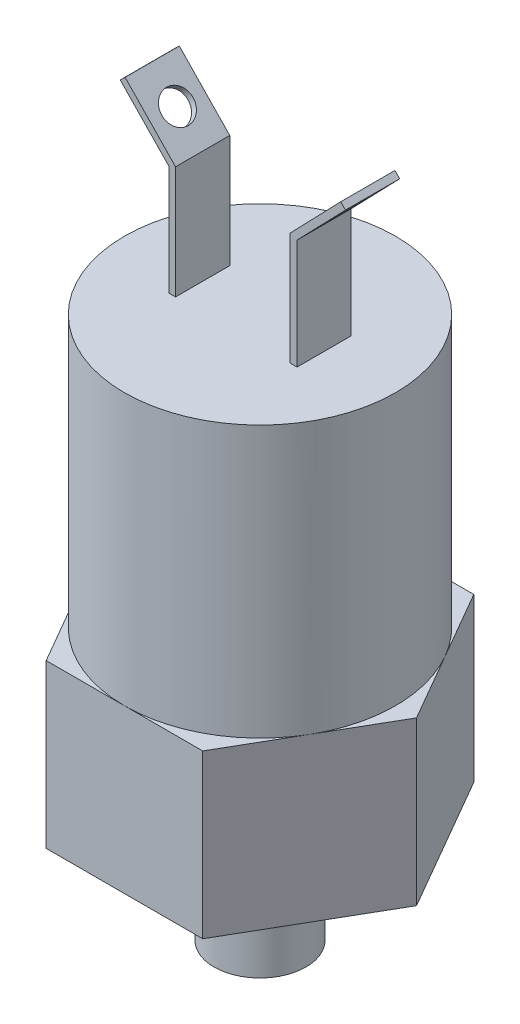
from build123d import *

# Parameters (mm, degrees)
BOSS_EXTRUDE1_DEPTH = 15.24
SKETCH3_R           = 12.7
BOSS_EXTRUDE2_DEPTH = 25.4
SKETCH4_R           = 4.3053
BOSS_EXTRUDE3_DEPTH = 10.16
EXTRUDE_THIN1_DEPTH = 2.54
CUT_EXTRUDE1_REACH  = 54.228
SKETCH6_R           = 1.4605


with BuildPart() as part:
    # Sketch2 → Boss-Extrude1 (new body)
    with BuildSketch(Plane(origin=(0, 0, 0), x_dir=(1, 0, 0), z_dir=(0, 1, 0))):
        Polygon((7.332348419, 12.7), (-7.332348419, 12.7), (-14.664696837, 0), (-7.332348419, -12.7), (7.332348419, -12.7), (14.664696837, 0), align=None)
    extrude(amount=BOSS_EXTRUDE1_DEPTH)

    # Sketch3 → Boss-Extrude2 (add)
    with BuildSketch(Plane(origin=(0, 15.24, 0), x_dir=(1, 0, 0), z_dir=(0, 1, 0))):
        with Locations(Location((0, 0, 0), (0, 0, 270))):
            Circle(SKETCH3_R)
    extrude(amount=BOSS_EXTRUDE2_DEPTH)

    # Sketch4 → Boss-Extrude3 (add)
    with BuildSketch(Plane.XZ):
        with Locations(Location((0, 0, 0), (0, 0, 90))):
            Circle(SKETCH4_R)
    extrude(amount=BOSS_EXTRUDE3_DEPTH)

    # Sketch5 → Extrude-Thin1 (add, symmetric)
    with BuildSketch(Plane.XY):
        Polygon((6.008182396, 40.64), (6.008182396, 50.946997676), (10.555270964, 55.659540341), (10.098307994, 56.100459659), (5.373182396, 51.203401761), (5.373182396, 40.64), align=None)
    extrude_thin1 = extrude(amount=EXTRUDE_THIN1_DEPTH, both=True)

    # Sketch6 → Cut-Extrude1 (cut, up to next)
    with BuildSketch(Plane(origin=(-22.802787707, 22.00219768, 0), x_dir=(0, 0, 1), z_dir=(-0.7196267237821845, 0.6943611296857851, 0)), mode=Mode.PRIVATE) as cut_extrude1_sk1:
        with Locations(Location((0, 43.980763894, 0), (0, 0, 270))):
            Circle(SKETCH6_R)
    cut_extrude1_tool1 = extrude(cut_extrude1_sk1.sketch, amount=-CUT_EXTRUDE1_REACH, mode=Mode.PRIVATE) & part.part
    cut_extrude1 = cut_extrude1_tool1.solids().sort_by_distance((7.735745, 53.651931, 0))[0]
    add(cut_extrude1, mode=Mode.SUBTRACT)

    # Mirror1: Extrude-Thin1, Cut-Extrude1 across plane
    add(extrude_thin1.mirror(Plane(origin=(0, 0, 0), x_dir=(0, 0, 1), z_dir=(1, 0, 0))))
    add(cut_extrude1.mirror(Plane(origin=(0, 0, 0), x_dir=(0, 0, 1), z_dir=(1, 0, 0))), mode=Mode.SUBTRACT)


solid = part.part
